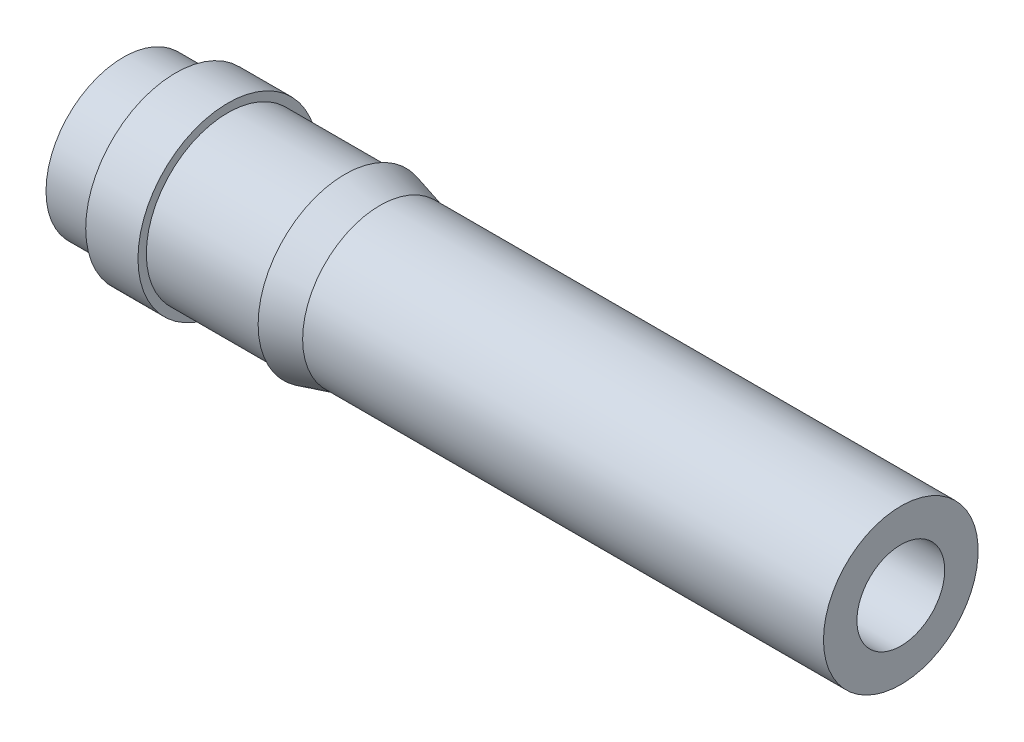
from build123d import *

# Parameters (mm, degrees)
HOLE1_D     = 0.70104
HOLE1_DEPTH = 3.937
HOLE1_TIP   = 0.210613664
HOLE2_D     = 0.5334
HOLE2_DEPTH = 4.7244
HOLE2_TIP   = 0.160249527


with BuildPart() as part:
    # Sketch1 → RevolutionAngle1 (revolve)
    with BuildSketch(Plane.XY, mode=Mode.PRIVATE) as revolutionangle1_sk:
        Polygon((0, 0), (0, 0.4699), (0.3175, 0.4699), (0.3175, 0.5461), (0.635, 0.5461), (0.635, 0.4953), (1.3462, 0.4953), (1.3462, 0.52705), (1.559486704, 0.4699), (4.7244, 0.4699), (4.7244, 0), align=None)
    revolve(revolutionangle1_sk.sketch.rotate(Axis((0, 0, 0), (1, 0, 0)), 90), axis=Axis((0, 0, 0), (1, 0, 0)))

    # Hole1
    with Locations(Plane.ZY):
        with Locations((0, 0)):
            Hole(HOLE1_D / 2, depth=HOLE1_DEPTH)
            with Locations((0, 0, -(HOLE1_DEPTH + HOLE1_TIP / 2))):  # 118° drill point
                Cone(0, HOLE1_D / 2, HOLE1_TIP, mode=Mode.SUBTRACT)

    # Hole2
    with Locations(Plane(origin=(4.7244, 0, 0), x_dir=(0, 0, -1), z_dir=(1, 0, 0))):
        with Locations((0, 0)):
            Hole(HOLE2_D / 2, depth=HOLE2_DEPTH)
            with Locations((0, 0, -(HOLE2_DEPTH + HOLE2_TIP / 2))):  # 118° drill point
                Cone(0, HOLE2_D / 2, HOLE2_TIP, mode=Mode.SUBTRACT)


solid = part.part
